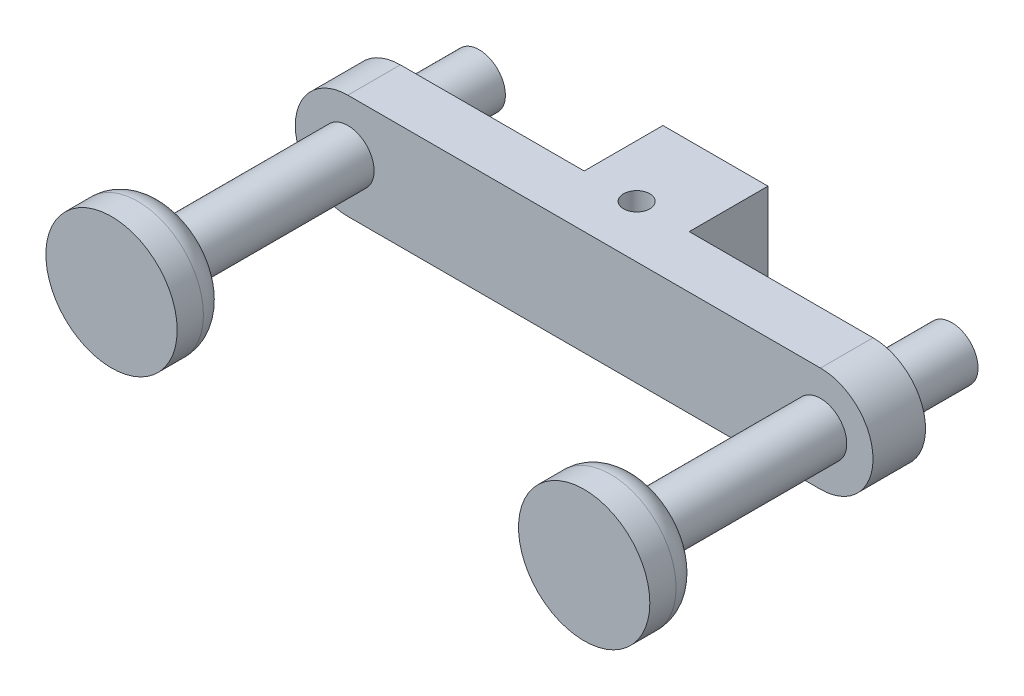
from build123d import *

# Parameters (mm, degrees)
SKETCH1_R                = 12.7
BOSS_EXTRUDE1_DEPTH      = 25.4
BOSS_EXTRUDE2_DEPTH      = 25.4
BOSS_EXTRUDE2_DEPTH_BACK = 25.4
SKETCH2_W                = 50.8
SKETCH2_H                = 38.1
SKETCH3_R                = 6.35
CUT_EXTRUDE1_DEPTH       = 154.454683865
SKETCH4_R                = 12.7
CUT_EXTRUDE2_DEPTH       = 12.7
SKETCH5_R                = 12.7
BOSS_EXTRUDE3_DEPTH      = 152.4
SKETCH6_R                = 31.75
BOSS_EXTRUDE4_DEPTH      = 25.4
FILLET1_R                = 12.7


with BuildPart() as part:
    # Sketch1 → Boss-Extrude1 (new body)
    with BuildSketch(Plane.XY):
        with BuildLine():
            Line((-114.3, 25.4), (114.3, 25.4))
            ThreePointArc((114.3, 25.4), (139.7, 0), (114.3, -25.4))
            Line((114.3, -25.4), (-114.3, -25.4))
            ThreePointArc((-114.3, -25.4), (-139.7, 0), (-114.3, 25.4))
        make_face()
        with Locations((-114.3, 0)):
            Circle(SKETCH1_R, mode=Mode.SUBTRACT)
        with Locations((114.3, 0)):
            Circle(SKETCH1_R, mode=Mode.SUBTRACT)
    extrude(amount=BOSS_EXTRUDE1_DEPTH)

    # Sketch2 → Boss-Extrude2 (add, two sides: drawn at the far end of the back side and taken through both)
    with BuildSketch(Plane(origin=(0, 0, 0), x_dir=(1, 0, 0), z_dir=(0, 1, 0)).offset(-BOSS_EXTRUDE2_DEPTH_BACK)):
        with Locations((0, 19.05)):
            Rectangle(SKETCH2_W, SKETCH2_H)
    extrude(amount=BOSS_EXTRUDE2_DEPTH + BOSS_EXTRUDE2_DEPTH_BACK)

    # Sketch3 → Cut-Extrude1 (cut, through all)
    with BuildSketch(Plane(origin=(0, 25.4, 0), x_dir=(1, 0, 0), z_dir=(0, 1, 0))):
        with Locations(Location((0, 0, 0), (0, 0, 270))):
            Circle(SKETCH3_R)
    extrude(amount=-CUT_EXTRUDE1_DEPTH, mode=Mode.SUBTRACT)

    # Sketch4 → Cut-Extrude2 (cut)
    with BuildSketch(Plane(origin=(0, 0, -38.1), x_dir=(-1, 0, 0), z_dir=(0, 0, -1))):
        Circle(SKETCH4_R)
    extrude(amount=-CUT_EXTRUDE2_DEPTH, mode=Mode.SUBTRACT)

    # Sketch5 → Boss-Extrude3 (add)
    with BuildSketch(Plane(origin=(0, 0, -38.1), x_dir=(-1, 0, 0), z_dir=(0, 0, -1))):
        with Locations((114.3, 0)):
            Circle(SKETCH5_R)
        with Locations((-114.3, 0)):
            Circle(SKETCH5_R)
    extrude(amount=-BOSS_EXTRUDE3_DEPTH)

    # Sketch6 → Boss-Extrude4 (add)
    with BuildSketch(Plane.XY.offset(114.3)):
        with Locations((-114.3, 0)):
            Circle(SKETCH6_R)
        with Locations((114.3, 0)):
            Circle(SKETCH6_R)
    extrude(amount=BOSS_EXTRUDE4_DEPTH)

    # Fillet1
    fillet1_edges = [part.edges().sort_by_distance(p)[0] for p in [
        (-146.05, 0, 114.3),
        (82.55, 0, 114.3),
    ]]
    fillet(fillet1_edges, radius=FILLET1_R)


solid = part.part
